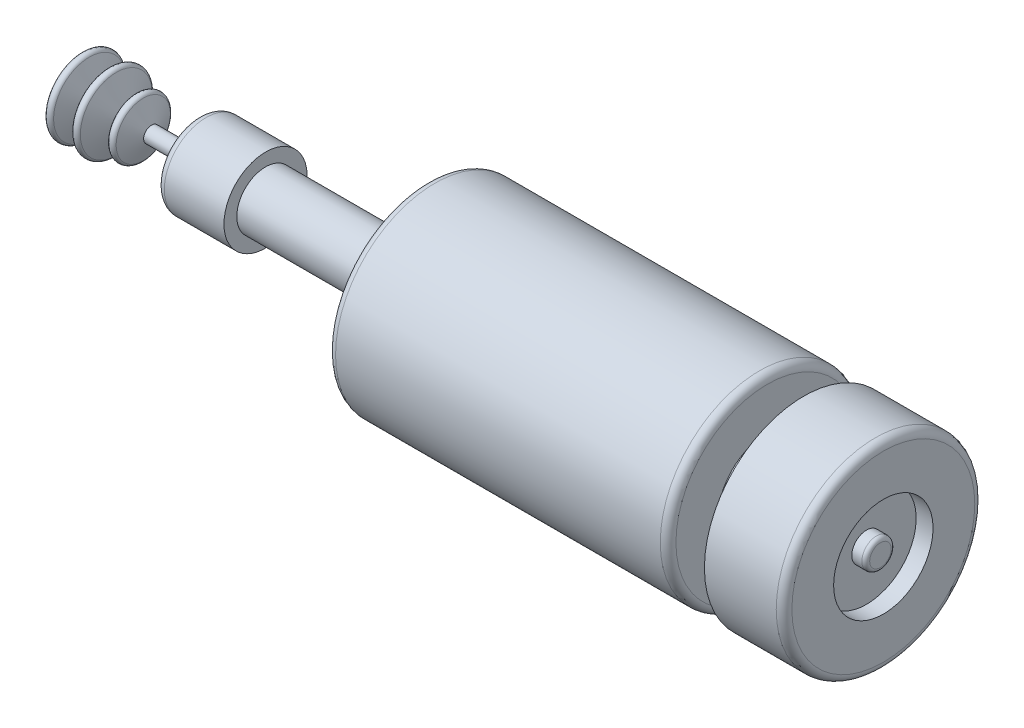
from build123d import *


with BuildPart() as part:
    # Esquisse1 → Révolution1 (revolve)
    with BuildSketch(Plane.XY, mode=Mode.PRIVATE) as r_volution1_sk:
        with BuildLine():
            Line((0, 0), (86.761420326, 0))
            Line((86.761420326, 0), (86.761420326, 2.74164683))
            ThreePointArc((86.761420326, 2.74164683), (86.468527107, 3.448753611), (85.761420326, 3.74164683))
            Line((85.761420326, 3.74164683), (85.5, 3.74164683))
            Line((85.5, 3.74164683), (83.192728647, 3.74164683))
            Line((83.192728647, 3.74164683), (83.192728647, 12.694324665))
            Line((83.192728647, 12.694324665), (87.5, 12.694324665))
            Line((87.5, 12.694324665), (87.5, 23.354706437))
            ThreePointArc((87.5, 23.354706437), (86.914213562, 24.768919999), (85.5, 25.354706437))
            Line((85.5, 25.354706437), (67.158669363, 25.354706437))
            Line((67.158669363, 25.354706437), (67.158669363, 3.74164683))
            Line((67.158669363, 3.74164683), (66.70100433, 3.74164683))
            Line((66.70100433, 3.74164683), (66.70100433, 4.072098059))
            Line((66.70100433, 4.072098059), (63.947251592, 4.072098059))
            Line((63.947251592, 4.072098059), (63.947251592, 12.677353218))
            Line((63.947251592, 12.677353218), (57.886953159, 12.677353218))
            Line((57.886953159, 12.677353218), (57.886953159, 23.354706437))
            ThreePointArc((57.886953159, 23.354706437), (57.301166721, 24.768919999), (55.886953159, 25.354706437))
            Line((55.886953159, 25.354706437), (-27.048297017, 25.354706437))
            ThreePointArc((-27.048297017, 25.354706437), (-28.462510579, 24.768919999), (-29.048297017, 23.354706437))
            Line((-29.048297017, 23.354706437), (-29.048297017, 12.677353218))
            Line((-29.048297017, 12.677353218), (-35.36187275, 12.677353218))
            Line((-35.36187275, 12.677353218), (-35.36187275, 4.072098059))
            Line((-35.36187275, 4.072098059), (-39.64758191, 4.072098059))
            Line((-39.64758191, 4.072098059), (-39.64758191, 7.350830254))
            Line((-39.64758191, 7.350830254), (-70.277797377, 7.350830254))
            Line((-70.277797377, 7.350830254), (-70.277797377, 10.628137258))
            Line((-70.277797377, 10.628137258), (-85.5, 10.628137258))
            ThreePointArc((-85.5, 10.628137258), (-86.914213562, 10.042350821), (-87.5, 8.628137258))
            Line((-87.5, 8.628137258), (-87.5, 2))
            Line((-87.5, 2), (-99.423318708, 2))
            Line((-99.423318708, 2), (-101.520739589, 6.918132627))
            ThreePointArc((-101.520739589, 6.918132627), (-102.350298756, 7.521765327), (-103.274886898, 7.077155817))
            Line((-103.274886898, 7.077155817), (-105.85381099, 3.174419416))
            Line((-105.85381099, 3.174419416), (-108.411929049, 9.172816783))
            ThreePointArc((-108.411929049, 9.172816783), (-109.241488216, 9.776449483), (-110.166076358, 9.331839973))
            Line((-110.166076358, 9.331839973), (-113.332355507, 4.540247645))
            Line((-113.332355507, 4.540247645), (-115.287928346, 9.125768211))
            ThreePointArc((-115.287928346, 9.125768211), (-116.267516733, 9.731698706), (-117.167840173, 9.013253944))
            Line((-117.167840173, 9.013253944), (-118.607720524, 4.072098059))
            Line((-118.607720524, 4.072098059), (-118.876557947, 0))
            Line((-118.876557947, 0), (-117.5, 0))
            Line((-117.5, 0), (-87.5, 0))
            Line((-87.5, 0), (0, 0))
        make_face()
    revolve(r_volution1_sk.sketch.rotate(Axis((0, 0, 0), (1, 0, 0)), 90), axis=Axis((0, 0, 0), (1, 0, 0)))


solid = part.part
